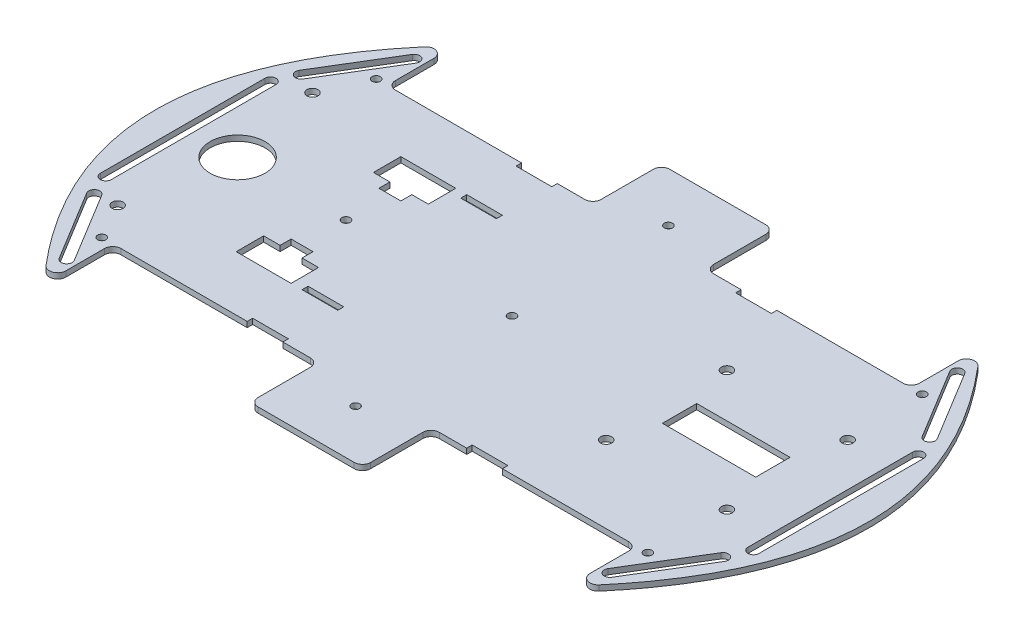
from build123d import *

# Parameters (mm, degrees)
SKETCH1_R           = 1.5
SKETCH1_R_2         = 2
SKETCH1_W           = 13
SKETCH1_H           = 2.19615452
SKETCH1_W_2         = 34
SKETCH1_H_2         = 12.5
SKETCH1_R_3         = 10
BOSS_EXTRUDE1_DEPTH = 2
FILLET1_R           = 3


with BuildPart() as part:
    # Sketch1 → Boss-Extrude1 (new body)
    with BuildSketch(Plane(origin=(0, 0, 0), x_dir=(1, 0, 0), z_dir=(0, 1, 0))):
        with BuildLine():
            Line((-95.5, 69), (-95.5, 75))
            add(Edge.make_bspline(
                [(-95.5, 75), (-130, 37.5), (-130, 0)],
                knots=[0, 0, 0, 0.5, 0.5, 0.5], degree=2))
            add(Edge.make_bspline(
                [(-130, 0), (-130, -37.5), (-95.5, -75)],
                knots=[0.5, 0.5, 0.5, 1, 1, 1], degree=2))
            Line((-95.5, -75), (-95.5, -50))
            Line((-95.5, -50), (-46.5, -50))
            Line((-46.5, -50), (-46.5, -48))
            Line((-46.5, -48), (-33.5, -48))
            Line((-33.5, -48), (-33.5, -50))
            Line((-33.5, -50), (-20.5, -50))
            Line((-20.5, -50), (-20.5, -75))
            Line((-20.5, -75), (20.5, -75))
            Line((20.5, -75), (20.5, -50))
            Line((20.5, -50), (33.5, -50))
            Line((33.5, -50), (33.5, -48))
            Line((33.5, -48), (46.5, -48))
            Line((46.5, -48), (46.5, -50))
            Line((46.5, -50), (95.5, -50))
            Line((95.5, -50), (95.5, -75))
            add(Edge.make_bspline(
                [(130, -5.22e-07), (129.99999976, -37.500000261), (95.5, -75)],
                knots=[0.500000003, 0.500000003, 0.500000003, 1, 1, 1], degree=2))
            add(Edge.make_bspline(
                [(95.5, 75), (130.00000024, 37.499999739), (130, -5.22e-07)],
                knots=[0, 0, 0, 0.500000003, 0.500000003, 0.500000003], degree=2))
            Line((95.5, 75), (95.5, 50))
            Line((95.5, 50), (46.5, 50))
            Line((46.5, 50), (46.5, 48))
            Line((46.5, 48), (33.5, 48))
            Line((33.5, 48), (33.5, 50))
            Line((33.5, 50), (20.5, 50))
            Line((20.5, 50), (20.5, 75))
            Line((20.5, 75), (0, 75))
            Line((0, 75), (-20.5, 75))
            Line((-20.5, 75), (-20.5, 50))
            Line((-20.5, 50), (-33.5, 50))
            Line((-33.5, 50), (-33.5, 48))
            Line((-33.5, 48), (-46.5, 48))
            Line((-46.5, 48), (-46.5, 50))
            Line((-46.5, 50), (-95.5, 50))
            Line((-95.5, 50), (-95.5, 69))
        make_face()
        with BuildLine():
            Line((-100.665133807, -64.355482792), (-116.252551949, -38.722839626))
            ThreePointArc((-116.252551949, -38.722839626), (-115.58287028, -35.974835539), (-112.834866193, -36.644517208))
            Line((-112.834866193, -36.644517208), (-97.247448051, -62.277160374))
            ThreePointArc((-97.247448051, -62.277160374), (-97.91712972, -65.025164461), (-100.665133807, -64.355482792))
        make_face(mode=Mode.SUBTRACT)
        with Locations(Location((-99.5, -50, 0), (0, 0, 270))):
            Circle(SKETCH1_R, mode=Mode.SUBTRACT)
        with Locations(Location((-106.75, -36.96363974, 0), (0, 0, 270))):
            Circle(SKETCH1_R_2, mode=Mode.SUBTRACT)
        with Locations((-40, -28.90192274)):
            Rectangle(SKETCH1_W, SKETCH1_H, mode=Mode.SUBTRACT)
        Polygon((-56.5, -16), (-56.5, -20), (-50.5, -20), (-50.5, -30), (-70.5, -30), (-70.5, -20), (-64.5, -20), (-64.5, -16), align=None, mode=Mode.SUBTRACT)
        with Locations(Location((0, -57, 0), (0, 0, 270))):
            Circle(SKETCH1_R, mode=Mode.SUBTRACT)
        with Locations(Location((99.5, -50, 0), (0, 0, 270))):
            Circle(SKETCH1_R, mode=Mode.SUBTRACT)
        with BuildLine():
            ThreePointArc((112.834866193, -36.644517208), (115.58287028, -35.974835539), (116.252551949, -38.722839626))
            Line((116.252551949, -38.722839626), (100.665133807, -64.355482792))
            ThreePointArc((100.665133807, -64.355482792), (97.91712972, -65.025164461), (97.247448051, -62.277160374))
            Line((97.247448051, -62.277160374), (112.834866193, -36.644517208))
        make_face(mode=Mode.SUBTRACT)
        with Locations(Location((56.310825718, -22, 0), (0, 0, 270))):
            Circle(SKETCH1_R_2, mode=Mode.SUBTRACT)
        with Locations(Location((100.310825718, -22, 0), (0, 0, 270))):
            Circle(SKETCH1_R_2, mode=Mode.SUBTRACT)
        with Locations((78.310825718, -0.25)):
            Rectangle(SKETCH1_W_2, SKETCH1_H_2, mode=Mode.SUBTRACT)
        with BuildLine():
            ThreePointArc((-120, 30), (-119.414213562, 31.414213562), (-118, 32))
            ThreePointArc((-118, 32), (-116.585786438, 31.414213562), (-116, 30))
            Line((-116, 30), (-116, -30))
            ThreePointArc((-116, -30), (-118, -32), (-120, -30))
            Line((-120, -30), (-120, 30))
        make_face(mode=Mode.SUBTRACT)
        with Locations(Location((-100, 0, 0), (0, 0, 270))):
            Circle(SKETCH1_R_3, mode=Mode.SUBTRACT)
        with Locations(Location((-106.75, 34.03636026, 0), (0, 0, 270))):
            Circle(SKETCH1_R_2, mode=Mode.SUBTRACT)
        with Locations(Location((-60.5, 0, 0), (0, 0, 270))):
            Circle(SKETCH1_R, mode=Mode.SUBTRACT)
        Polygon((-70.5, 30), (-50.5, 30), (-50.5, 20), (-56.5, 20), (-56.5, 16), (-64.5, 16), (-64.5, 20), (-70.5, 20), align=None, mode=Mode.SUBTRACT)
        with Locations((-40, 28.90192274)):
            Rectangle(SKETCH1_W, SKETCH1_H, mode=Mode.SUBTRACT)
        with BuildLine():
            ThreePointArc((-100.665133807, 64.355482792), (-99.429827378, 65.259453908), (-97.91712972, 65.025164461))
            ThreePointArc((-97.91712972, 65.025164461), (-97.013158604, 63.789858032), (-97.247448051, 62.277160374))
            Line((-97.247448051, 62.277160374), (-112.834866193, 36.644517208))
            ThreePointArc((-112.834866193, 36.644517208), (-114.070172622, 35.740546092), (-115.58287028, 35.974835539))
            ThreePointArc((-115.58287028, 35.974835539), (-116.486841396, 37.210141968), (-116.252551949, 38.722839626))
            Line((-116.252551949, 38.722839626), (-100.665133807, 64.355482792))
        make_face(mode=Mode.SUBTRACT)
        with Locations(Location((-99.5, 50, 0), (0, 0, 270))):
            Circle(SKETCH1_R, mode=Mode.SUBTRACT)
        with Locations(Location((0, 0, 0), (0, 0, 270))):
            Circle(SKETCH1_R, mode=Mode.SUBTRACT)
        with Locations(Location((56.310825718, 22, 0), (0, 0, 270))):
            Circle(SKETCH1_R_2, mode=Mode.SUBTRACT)
        with BuildLine():
            Line((116, -30), (116, 30))
            ThreePointArc((116, 30), (118, 32), (120, 30))
            Line((120, 30), (120, -30))
            ThreePointArc((120, -30), (118, -32), (116, -30))
        make_face(mode=Mode.SUBTRACT)
        with Locations(Location((100.310825718, 22, 0), (0, 0, 270))):
            Circle(SKETCH1_R_2, mode=Mode.SUBTRACT)
        with BuildLine():
            ThreePointArc((1.5, 57), (-1.060660172, 55.939339828), (0, 58.5))
            ThreePointArc((0, 58.5), (1.060660172, 58.060660172), (1.5, 57))
        make_face(mode=Mode.SUBTRACT)
        with Locations(Location((99.5, 50, 0), (0, 0, 270))):
            Circle(SKETCH1_R, mode=Mode.SUBTRACT)
        with BuildLine():
            Line((100.665133807, 64.355482792), (116.252551949, 38.722839626))
            ThreePointArc((116.252551949, 38.722839626), (115.58287028, 35.974835539), (112.834866193, 36.644517208))
            Line((112.834866193, 36.644517208), (97.247448051, 62.277160374))
            ThreePointArc((97.247448051, 62.277160374), (97.91712972, 65.025164461), (100.665133807, 64.355482792))
        make_face(mode=Mode.SUBTRACT)
    extrude(amount=BOSS_EXTRUDE1_DEPTH)

    # Fillet1
    fillet1_edges = [part.edges().sort_by_distance(p)[0] for p in [
        (-20.5, 1, -50),
        (-20.5, 1, -75),
        (95.5, 1, -75),
        (20.5, 1, -75),
        (20.5, 1, -50),
        (95.5, 1, -50),
        (95.5, 1, 75),
        (95.5, 1, 50),
        (20.5, 1, 50),
        (20.5, 1, 75),
        (-20.5, 1, 75),
        (-20.5, 1, 50),
        (-95.5, 1, 50),
        (-95.5, 1, -50),
        (-95.5, 1, -75),
        (-95.5, 1, 75),
    ]]
    fillet(fillet1_edges, radius=FILLET1_R)


solid = part.part
